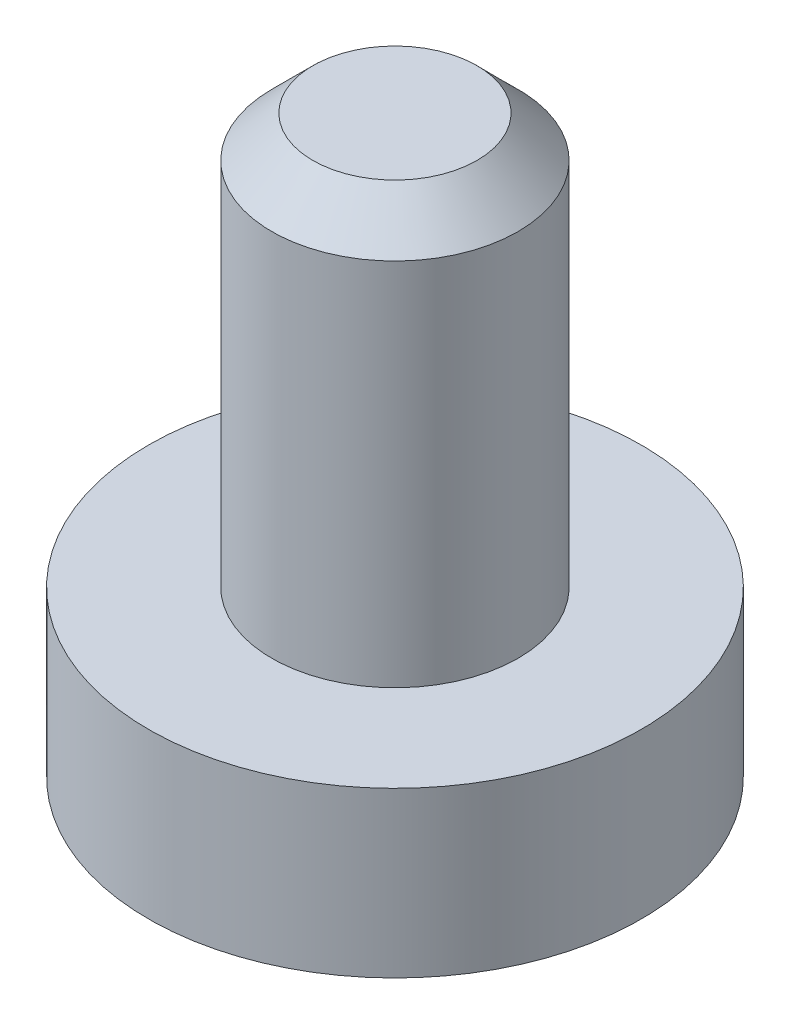
from build123d import *

# Parameters (mm, degrees)
CHAMFER1_SIZE = 0.5


with BuildPart() as part:
    # Sketch1 → Revolve1 (revolve)
    with BuildSketch(Plane.XY, mode=Mode.PRIVATE) as revolve1_sk:
        Polygon((0, 0), (3, 0), (3, 2), (1.5, 2), (1.5, 7), (0, 7), align=None)
    revolve(revolve1_sk.sketch.rotate(Axis((0, 7, 0), (0, -1, 0)), 180), axis=Axis((0, 7, 0), (0, -1, 0)))

    # Chamfer1
    chamfer1_edges = [part.edges().sort_by_distance(p)[0] for p in [
        (1.5, 7, 0),
    ]]
    chamfer(chamfer1_edges, length=CHAMFER1_SIZE)


solid = part.part
